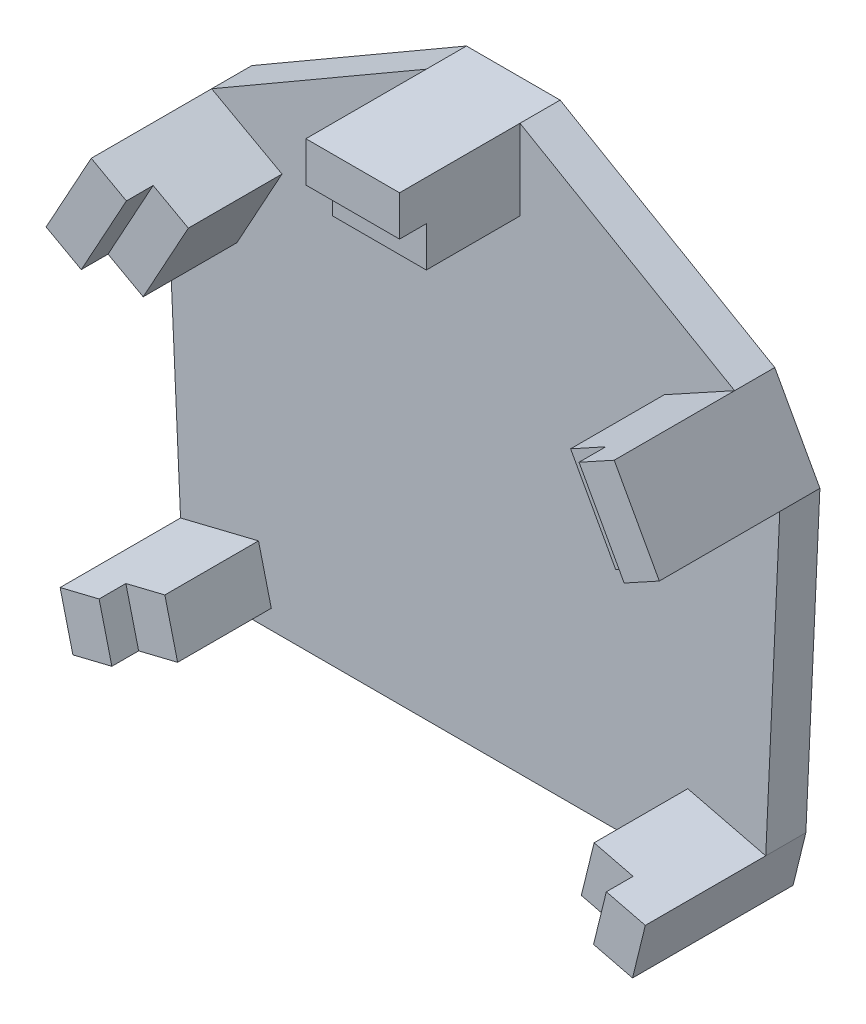
from build123d import *

# Parameters (mm, degrees)
SKETCH2_W             = 7
SKETCH2_H             = 3
BOSS_EXTRUDE1_DEPTH   = 2
BOSS_EXTRUDE1_2_DEPTH = 2
BOSS_EXTRUDE1_3_DEPTH = 2
BOSS_EXTRUDE1_4_DEPTH = 2
BOSS_EXTRUDE1_5_DEPTH = 2
SKETCH3_W             = 7
SKETCH3_H             = 6
BOSS_EXTRUDE2_DEPTH   = 7
BOSS_EXTRUDE3_DEPTH   = 3


with BuildPart() as part:
    # Sketch2 → Boss-Extrude1 (new body)
    with BuildSketch(Plane.XY):
        with Locations((0, 28.5)):
            Rectangle(SKETCH2_W, SKETCH2_H)
    extrude(amount=BOSS_EXTRUDE1_DEPTH)



with BuildPart() as body_2:
    # Sketch2 → Boss-Extrude1 2 (new body)
    with BuildSketch(Plane.XY):
        Polygon((-18.954098941, -7.515454311), (-18, -11.4), (-20.913409267, -12.115574206), (-21.867508208, -8.231028517), align=None)
    extrude(amount=BOSS_EXTRUDE1_2_DEPTH)


with BuildPart() as body_3:
    # Sketch2 → Boss-Extrude1 3 (new body)
    with BuildSketch(Plane.XY):
        Polygon((-20.286715624, 13.13324432), (-16.913284376, 19.26675568), (-19.541932102, 20.71251193), (-22.91536335, 14.579000569), align=None)
    extrude(amount=BOSS_EXTRUDE1_3_DEPTH)


with BuildPart() as body_4:
    # Sketch2 → Boss-Extrude1 4 (new body)
    with BuildSketch(Plane.XY):
        Polygon((22.91536335, 14.579000569), (19.541932102, 20.71251193), (16.913284376, 19.26675568), (20.286715624, 13.13324432), align=None)
    extrude(amount=BOSS_EXTRUDE1_4_DEPTH)


with BuildPart() as body_5:
    # Sketch2 → Boss-Extrude1 5 (new body)
    with BuildSketch(Plane.XY):
        Polygon((21.867508208, -8.231028517), (20.913409267, -12.115574206), (18, -11.4), (18.954098941, -7.515454311), align=None)
    extrude(amount=BOSS_EXTRUDE1_5_DEPTH)


with BuildPart() as part_1:
    add(part.part)

    add(body_2.part)  # Boss-Extrude2 merges body 2

    add(body_3.part)  # Boss-Extrude2 merges body 3

    add(body_4.part)  # Boss-Extrude2 merges body 4

    add(body_5.part)  # Boss-Extrude2 merges body 5
    # Sketch3 → Boss-Extrude2 (add)
    with BuildSketch(Plane.XY):
        Polygon((20.913409267, -12.115574206), (21.867508208, -8.231028517), (16.040689674, -6.799880105), (15.086590733, -10.684425794), align=None)
        Polygon((22.91536335, 14.579000569), (19.541932102, 20.71251193), (14.28463665, 17.820999431), (17.658067898, 11.68748807), align=None)
        with Locations((0, 27)):
            Rectangle(SKETCH3_W, SKETCH3_H)
        Polygon((-17.658067898, 11.68748807), (-14.28463665, 17.820999431), (-19.541932102, 20.71251193), (-22.91536335, 14.579000569), align=None)
        Polygon((-15.086590733, -10.684425794), (-16.040689674, -6.799880105), (-21.867508208, -8.231028517), (-20.913409267, -12.115574206), align=None)
    extrude(amount=-BOSS_EXTRUDE2_DEPTH)

    # Sketch4 → Boss-Extrude3 (add)
    with BuildSketch(Plane(origin=(0, 0, -7), x_dir=(-1, 0, 0), z_dir=(0, 0, -1))):
        Polygon((-21.867508208, -8.231028517), (-22.91536335, 14.579000569), (-19.541932102, 20.71251193), (-3.5, 30), (3.5, 30), (19.541932102, 20.71251193), (22.91536335, 14.579000569), (21.867508208, -8.231028517), (20.913409267, -12.115574206), (-20.913409267, -12.115574206), align=None)
    extrude(amount=BOSS_EXTRUDE3_DEPTH)


solid = part_1.part
